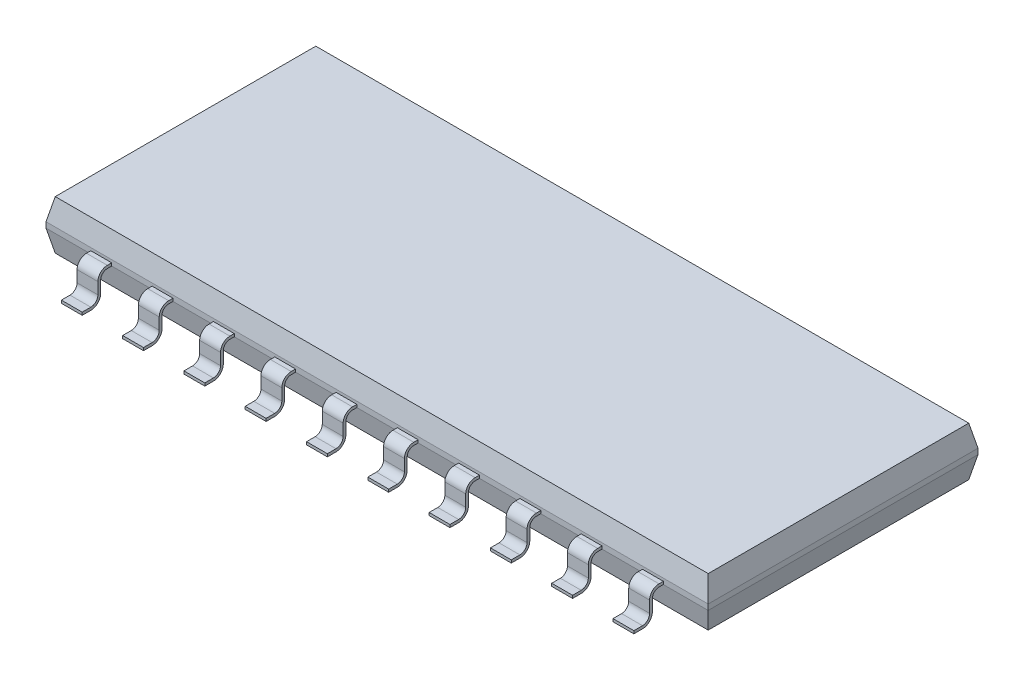
from build123d import *
from OCP.BRepFilletAPI import BRepFilletAPI_MakeChamfer

# Parameters (mm, degrees)
SKETCH1_W              = 13.72
SKETCH1_H              = 5.59
BOSS_EXTRUDE1_DEPTH    = 0.5075
CHAMFER1_SIZE          = 0.45
CHAMFER1_SIZE2         = 0.095650453
CHAMFER3_SIZE          = 0.45
CHAMFER3_SIZE2         = 0.095650453
BOSS_EXTRUDE2_START    = -0.6375
SKETCH4_W              = 0.432
SKETCH4_H              = 0.611
BOSS_EXTRUDE2_DEPTH    = 0.6375
BOSS_EXTRUDE2_2_DEPTH  = 0.6375
BOSS_EXTRUDE2_3_DEPTH  = 0.6375
BOSS_EXTRUDE2_4_DEPTH  = 0.6375
BOSS_EXTRUDE2_5_DEPTH  = 0.6375
BOSS_EXTRUDE2_6_DEPTH  = 0.6375
BOSS_EXTRUDE2_7_DEPTH  = 0.6375
BOSS_EXTRUDE2_8_DEPTH  = 0.6375
BOSS_EXTRUDE2_9_DEPTH  = 0.6375
BOSS_EXTRUDE2_10_DEPTH = 0.6375
CUT_EXTRUDE1_DEPTH     = 14.252053548


with BuildPart() as part:
    # Sketch1 → Boss-Extrude1 (new, symmetric)
    with BuildSketch(Plane(origin=(0, 0, 0), x_dir=(1, 0, 0), z_dir=(0, 1, 0))):
        Rectangle(SKETCH1_W, SKETCH1_H)
    extrude(amount=BOSS_EXTRUDE1_DEPTH, both=True)

    # Chamfer1: one chamfer whose edges measure the first distance from different faces: ONE call of the kernel's chamfer builder (chamfer() names one face for all edges)
    chamfer1_edges_1 = [part.edges().sort_by_distance(p)[0] for p in [
        (-6.86, 0.5075, 0),
    ]]
    chamfer1_side_1 = [part.faces().sort_by_distance(p)[0] for p in [
        (-6.86, 0, 0),
    ]]
    chamfer1_edges_2 = [part.edges().sort_by_distance(p)[0] for p in [
        (0, 0.5075, 2.795),
    ]]
    chamfer1_side_2 = [part.faces().sort_by_distance(p)[0] for p in [
        (0, 0, 2.795),
    ]]
    chamfer1_edges_3 = [part.edges().sort_by_distance(p)[0] for p in [
        (6.86, 0.5075, 0),
    ]]
    chamfer1_side_3 = [part.faces().sort_by_distance(p)[0] for p in [
        (6.86, 0, 0),
    ]]
    chamfer1_edges_4 = [part.edges().sort_by_distance(p)[0] for p in [
        (0, 0.5075, -2.795),
    ]]
    chamfer1_side_4 = [part.faces().sort_by_distance(p)[0] for p in [
        (0, 0, -2.795),
    ]]
    chamfer1 = BRepFilletAPI_MakeChamfer(part.part.solid().wrapped)
    for e in chamfer1_edges_1:
        chamfer1.Add(CHAMFER1_SIZE, CHAMFER1_SIZE2, e.wrapped, chamfer1_side_1[0].wrapped)  # the first distance lies on this face
    for e in chamfer1_edges_2:
        chamfer1.Add(CHAMFER1_SIZE, CHAMFER1_SIZE2, e.wrapped, chamfer1_side_2[0].wrapped)  # the first distance lies on this face
    for e in chamfer1_edges_3:
        chamfer1.Add(CHAMFER1_SIZE, CHAMFER1_SIZE2, e.wrapped, chamfer1_side_3[0].wrapped)  # the first distance lies on this face
    for e in chamfer1_edges_4:
        chamfer1.Add(CHAMFER1_SIZE, CHAMFER1_SIZE2, e.wrapped, chamfer1_side_4[0].wrapped)  # the first distance lies on this face
    add(Compound.cast(chamfer1.Shape()), mode=Mode.REPLACE)

    # Chamfer3: one chamfer whose edges measure the first distance from different faces: ONE call of the kernel's chamfer builder (chamfer() names one face for all edges)
    chamfer3_edges_1 = [part.edges().sort_by_distance(p)[0] for p in [
        (0, -0.5075, 2.795),
    ]]
    chamfer3_side_1 = [part.faces().sort_by_distance(p)[0] for p in [
        (0, -0.225, 2.795),
    ]]
    chamfer3_edges_2 = [part.edges().sort_by_distance(p)[0] for p in [
        (-6.86, -0.5075, 0),
    ]]
    chamfer3_side_2 = [part.faces().sort_by_distance(p)[0] for p in [
        (-6.86, -0.225, 0),
    ]]
    chamfer3_edges_3 = [part.edges().sort_by_distance(p)[0] for p in [
        (0, -0.5075, -2.795),
    ]]
    chamfer3_side_3 = [part.faces().sort_by_distance(p)[0] for p in [
        (0, -0.225, -2.795),
    ]]
    chamfer3_edges_4 = [part.edges().sort_by_distance(p)[0] for p in [
        (6.86, -0.5075, 0),
    ]]
    chamfer3_side_4 = [part.faces().sort_by_distance(p)[0] for p in [
        (6.86, -0.225, 0),
    ]]
    chamfer3 = BRepFilletAPI_MakeChamfer(part.part.solid().wrapped)
    for e in chamfer3_edges_1:
        chamfer3.Add(CHAMFER3_SIZE, CHAMFER3_SIZE2, e.wrapped, chamfer3_side_1[0].wrapped)  # the first distance lies on this face
    for e in chamfer3_edges_2:
        chamfer3.Add(CHAMFER3_SIZE, CHAMFER3_SIZE2, e.wrapped, chamfer3_side_2[0].wrapped)  # the first distance lies on this face
    for e in chamfer3_edges_3:
        chamfer3.Add(CHAMFER3_SIZE, CHAMFER3_SIZE2, e.wrapped, chamfer3_side_3[0].wrapped)  # the first distance lies on this face
    for e in chamfer3_edges_4:
        chamfer3.Add(CHAMFER3_SIZE, CHAMFER3_SIZE2, e.wrapped, chamfer3_side_4[0].wrapped)  # the first distance lies on this face
    add(Compound.cast(chamfer3.Shape()), mode=Mode.REPLACE)


with BuildPart() as body_2:
    # Sketch4 → Boss-Extrude2 (new body)
    with BuildSketch(Plane(origin=(0, -0.6375, 0), x_dir=(-1, 0, 0), z_dir=(0, -1, 0)).offset(BOSS_EXTRUDE2_START)):
        with Locations((-4.445, -3.1005)):
            Rectangle(SKETCH4_W, SKETCH4_H)
    boss_extrude2 = extrude(amount=BOSS_EXTRUDE2_DEPTH)


with BuildPart() as body_3:
    # Sketch4 → Boss-Extrude2 2 (new body)
    with BuildSketch(Plane(origin=(0, -0.6375, 0), x_dir=(-1, 0, 0), z_dir=(0, -1, 0)).offset(BOSS_EXTRUDE2_START)):
        with Locations((-5.715, -3.1005)):
            Rectangle(SKETCH4_W, SKETCH4_H)
    boss_extrude2_2 = extrude(amount=BOSS_EXTRUDE2_2_DEPTH)


with BuildPart() as body_4:
    # Sketch4 → Boss-Extrude2 3 (new body)
    with BuildSketch(Plane(origin=(0, -0.6375, 0), x_dir=(-1, 0, 0), z_dir=(0, -1, 0)).offset(BOSS_EXTRUDE2_START)):
        with Locations((-3.175, -3.1005)):
            Rectangle(SKETCH4_W, SKETCH4_H)
    boss_extrude2_3 = extrude(amount=BOSS_EXTRUDE2_3_DEPTH)


with BuildPart() as body_5:
    # Sketch4 → Boss-Extrude2 4 (new body)
    with BuildSketch(Plane(origin=(0, -0.6375, 0), x_dir=(-1, 0, 0), z_dir=(0, -1, 0)).offset(BOSS_EXTRUDE2_START)):
        with Locations((-1.905, -3.1005)):
            Rectangle(SKETCH4_W, SKETCH4_H)
    boss_extrude2_4 = extrude(amount=BOSS_EXTRUDE2_4_DEPTH)


with BuildPart() as body_6:
    # Sketch4 → Boss-Extrude2 5 (new body)
    with BuildSketch(Plane(origin=(0, -0.6375, 0), x_dir=(-1, 0, 0), z_dir=(0, -1, 0)).offset(BOSS_EXTRUDE2_START)):
        with Locations((-0.635, -3.1005)):
            Rectangle(SKETCH4_W, SKETCH4_H)
    boss_extrude2_5 = extrude(amount=BOSS_EXTRUDE2_5_DEPTH)


with BuildPart() as body_7:
    # Sketch4 → Boss-Extrude2 6 (new body)
    with BuildSketch(Plane(origin=(0, -0.6375, 0), x_dir=(-1, 0, 0), z_dir=(0, -1, 0)).offset(BOSS_EXTRUDE2_START)):
        with Locations((0.635, -3.1005)):
            Rectangle(SKETCH4_W, SKETCH4_H)
    boss_extrude2_6 = extrude(amount=BOSS_EXTRUDE2_6_DEPTH)


with BuildPart() as body_8:
    # Sketch4 → Boss-Extrude2 7 (new body)
    with BuildSketch(Plane(origin=(0, -0.6375, 0), x_dir=(-1, 0, 0), z_dir=(0, -1, 0)).offset(BOSS_EXTRUDE2_START)):
        with Locations((1.905, -3.1005)):
            Rectangle(SKETCH4_W, SKETCH4_H)
    boss_extrude2_7 = extrude(amount=BOSS_EXTRUDE2_7_DEPTH)


with BuildPart() as body_9:
    # Sketch4 → Boss-Extrude2 8 (new body)
    with BuildSketch(Plane(origin=(0, -0.6375, 0), x_dir=(-1, 0, 0), z_dir=(0, -1, 0)).offset(BOSS_EXTRUDE2_START)):
        with Locations((3.175, -3.1005)):
            Rectangle(SKETCH4_W, SKETCH4_H)
    boss_extrude2_8 = extrude(amount=BOSS_EXTRUDE2_8_DEPTH)


with BuildPart() as body_10:
    # Sketch4 → Boss-Extrude2 9 (new body)
    with BuildSketch(Plane(origin=(0, -0.6375, 0), x_dir=(-1, 0, 0), z_dir=(0, -1, 0)).offset(BOSS_EXTRUDE2_START)):
        with Locations((4.445, -3.1005)):
            Rectangle(SKETCH4_W, SKETCH4_H)
    boss_extrude2_9 = extrude(amount=BOSS_EXTRUDE2_9_DEPTH)


with BuildPart() as body_11:
    # Sketch4 → Boss-Extrude2 10 (new body)
    with BuildSketch(Plane(origin=(0, -0.6375, 0), x_dir=(-1, 0, 0), z_dir=(0, -1, 0)).offset(BOSS_EXTRUDE2_START)):
        with Locations((5.715, -3.1005)):
            Rectangle(SKETCH4_W, SKETCH4_H)
    boss_extrude2_10 = extrude(amount=BOSS_EXTRUDE2_10_DEPTH)


with BuildPart() as cut_extrude1_tool:
    # Sketch5 → Cut-Extrude1 (new, through all)
    with BuildSketch(Plane(origin=(5.931, 0, 0), x_dir=(0, 0, -1), z_dir=(1, 0, 0))):
        with BuildLine():
            Line((-2.795, -0.6375), (-2.795, -0.0575))
            Line((-2.795, -0.0575), (-2.885196168, -0.0575))
            ThreePointArc((-2.885196168, -0.0575), (-2.982379227, -0.097754541), (-3.022633768, -0.1949376))
            Line((-3.022633768, -0.1949376), (-3.022633768, -0.432788883))
            ThreePointArc((-3.022633768, -0.432788883), (-3.082592267, -0.577541502), (-3.227344886, -0.6375))
            Line((-3.227344886, -0.6375), (-2.795, -0.6375))
        make_face()
        with BuildLine():
            Line((-3.406, 0), (-3.406, -0.58))
            Line((-3.406, -0.58), (-3.227344886, -0.58))
            ThreePointArc((-3.227344886, -0.58), (-3.123250907, -0.536882862), (-3.080133768, -0.432788883))
            Line((-3.080133768, -0.432788883), (-3.080133768, -0.1949376))
            ThreePointArc((-3.080133768, -0.1949376), (-3.023037867, -0.057095901), (-2.885196168, 0))
            Line((-2.885196168, 0), (-3.406, 0))
        make_face()
    cut_extrude1 = extrude(amount=-CUT_EXTRUDE1_DEPTH)


with BuildPart() as body_2_1:
    add(body_2.part)

    # Cut-Extrude1: cut by cut_extrude1_tool
    add(cut_extrude1_tool.part, mode=Mode.SUBTRACT)


with BuildPart() as body_3_1:
    add(body_3.part)

    # Cut-Extrude1: cut by cut_extrude1_tool
    add(cut_extrude1_tool.part, mode=Mode.SUBTRACT)


with BuildPart() as body_4_1:
    add(body_4.part)

    # Cut-Extrude1: cut by cut_extrude1_tool
    add(cut_extrude1_tool.part, mode=Mode.SUBTRACT)


with BuildPart() as body_5_1:
    add(body_5.part)

    # Cut-Extrude1: cut by cut_extrude1_tool
    add(cut_extrude1_tool.part, mode=Mode.SUBTRACT)


with BuildPart() as body_6_1:
    add(body_6.part)

    # Cut-Extrude1: cut by cut_extrude1_tool
    add(cut_extrude1_tool.part, mode=Mode.SUBTRACT)


with BuildPart() as body_7_1:
    add(body_7.part)

    # Cut-Extrude1: cut by cut_extrude1_tool
    add(cut_extrude1_tool.part, mode=Mode.SUBTRACT)


with BuildPart() as body_8_1:
    add(body_8.part)

    # Cut-Extrude1: cut by cut_extrude1_tool
    add(cut_extrude1_tool.part, mode=Mode.SUBTRACT)


with BuildPart() as body_9_1:
    add(body_9.part)

    # Cut-Extrude1: cut by cut_extrude1_tool
    add(cut_extrude1_tool.part, mode=Mode.SUBTRACT)


with BuildPart() as body_10_1:
    add(body_10.part)

    # Cut-Extrude1: cut by cut_extrude1_tool
    add(cut_extrude1_tool.part, mode=Mode.SUBTRACT)


with BuildPart() as body_11_1:
    add(body_11.part)

    # Cut-Extrude1: cut by cut_extrude1_tool
    add(cut_extrude1_tool.part, mode=Mode.SUBTRACT)


with BuildPart() as part_1:
    add(part.part)

    # Mirror1: Boss-Extrude2, Boss-Extrude2 2, Boss-Extrude2 3, Boss-Extrude2 4, Boss-Extrude2 5, Boss-Extrude2 6, Boss-Extrude2 7, Boss-Extrude2 8, Boss-Extrude2 9, Boss-Extrude2 10, Cut-Extrude1 across plane
    add(boss_extrude2.mirror(Plane.XY))
    add(boss_extrude2_2.mirror(Plane.XY))
    add(boss_extrude2_3.mirror(Plane.XY))
    add(boss_extrude2_4.mirror(Plane.XY))
    add(boss_extrude2_5.mirror(Plane.XY))
    add(boss_extrude2_6.mirror(Plane.XY))
    add(boss_extrude2_7.mirror(Plane.XY))
    add(boss_extrude2_8.mirror(Plane.XY))
    add(boss_extrude2_9.mirror(Plane.XY))
    add(boss_extrude2_10.mirror(Plane.XY))
    add(cut_extrude1.mirror(Plane.XY), mode=Mode.SUBTRACT)


solid = Compound([body_2_1.part, body_3_1.part, body_4_1.part, body_5_1.part, body_6_1.part, body_7_1.part, body_8_1.part, body_9_1.part, body_10_1.part, body_11_1.part, part_1.part])
